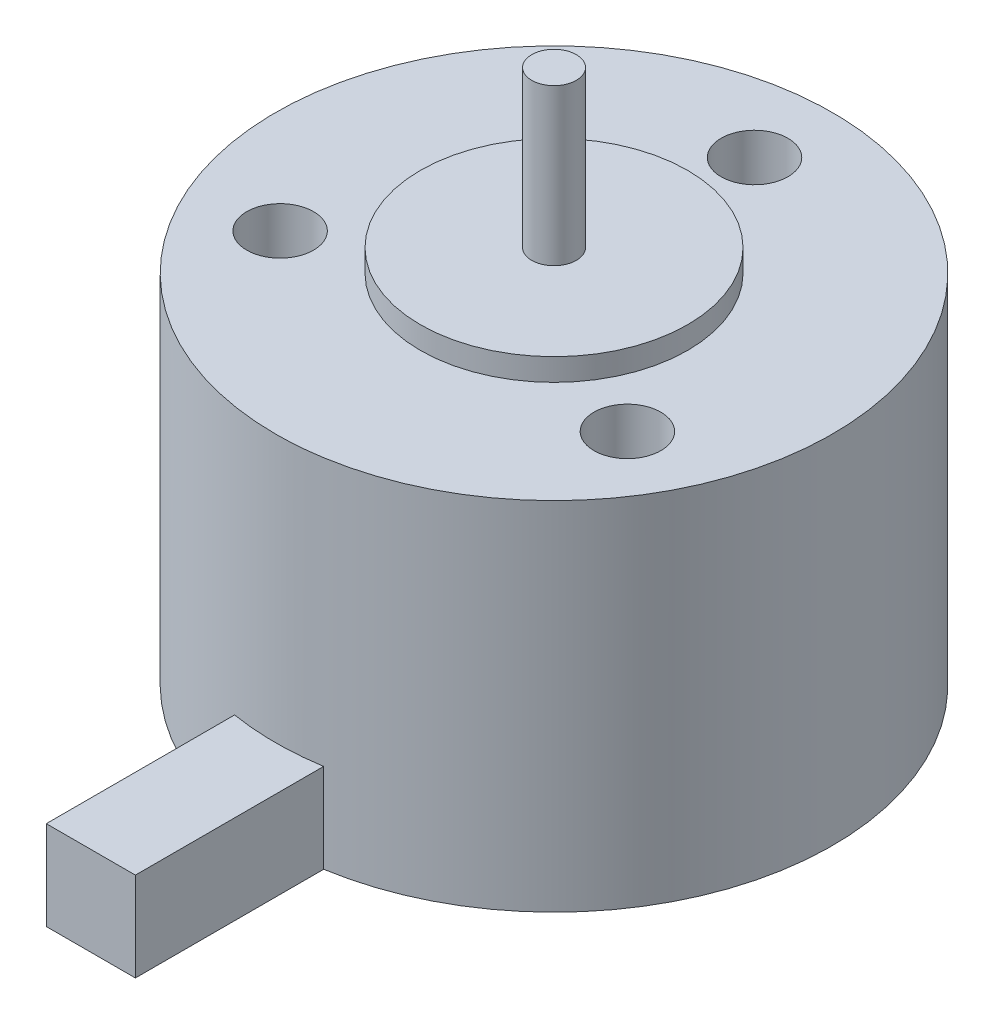
from build123d import *

# Parameters (mm, degrees)
ESQUISSE1_R                  = 12.5
BOSS_EXTRU_1_DEPTH           = 16
ESQUISSE2_R                  = 1
BOSS_EXTRU_2_DEPTH           = 8
BOSS_EXTRU_3_DEPTH           = 4
ESQUISSE5_R                  = 1.5
ENL_V_MAT_EXTRU_1_DEPTH      = 5
R_P_TITION_CIRCULAIRE1_COUNT = 3
ESQUISSE6_R                  = 6
BOSS_EXTRU_4_DEPTH           = 1


with BuildPart() as part:
    # Esquisse1 → Boss.-Extru.1 (new body)
    with BuildSketch(Plane(origin=(0, 0, 0), x_dir=(1, 0, 0), z_dir=(0, 1, 0))):
        with Locations(Location((0, 0, 0), (0, 0, 270))):
            Circle(ESQUISSE1_R)
    extrude(amount=BOSS_EXTRU_1_DEPTH)

    # Esquisse2 → Boss.-Extru.2 (add)
    with BuildSketch(Plane(origin=(0, 16, 0), x_dir=(1, 0, 0), z_dir=(0, 1, 0))):
        with Locations(Location((0, 0, 0), (0, 0, 270))):
            Circle(ESQUISSE2_R)
    extrude(amount=BOSS_EXTRU_2_DEPTH)

    # Esquisse4 → Boss.-Extru.3 (add)
    with BuildSketch(Plane.XZ):
        Polygon((0, 20.790629037), (2, 20.790629037), (2, 9.492710375), (0, 9.492710375), (-2, 9.492710375), (-2, 20.790629037), align=None)
    extrude(amount=-BOSS_EXTRU_3_DEPTH)

    # Esquisse5 → Enlèv. mat.-Extru.1 (cut)
    with BuildSketch(Plane(origin=(0, 16, 0), x_dir=(1, 0, 0), z_dir=(0, 1, 0))):
        with Locations(Location((0, 9, 0), (0, 0, 270))):
            Circle(ESQUISSE5_R)
    enl_v_mat_extru_1 = extrude(amount=-ENL_V_MAT_EXTRU_1_DEPTH, mode=Mode.SUBTRACT)

    # Répétition circulaire1: Enlèv. mat.-Extru.1 ×3 about axis
    r_p_tition_circulaire1_axis = Axis((0, 0, 0), (0, 1, 0))
    for i in range(1, R_P_TITION_CIRCULAIRE1_COUNT):
        add(enl_v_mat_extru_1.rotate(r_p_tition_circulaire1_axis, i * 360 / R_P_TITION_CIRCULAIRE1_COUNT), mode=Mode.SUBTRACT)

    # Esquisse6 → Boss.-Extru.4 (add)
    with BuildSketch(Plane(origin=(0, 16, 0), x_dir=(1, 0, 0), z_dir=(0, 1, 0))):
        with Locations(Location((0, 0, 0), (0, 0, 270))):
            Circle(ESQUISSE6_R)
    extrude(amount=BOSS_EXTRU_4_DEPTH)


solid = part.part
